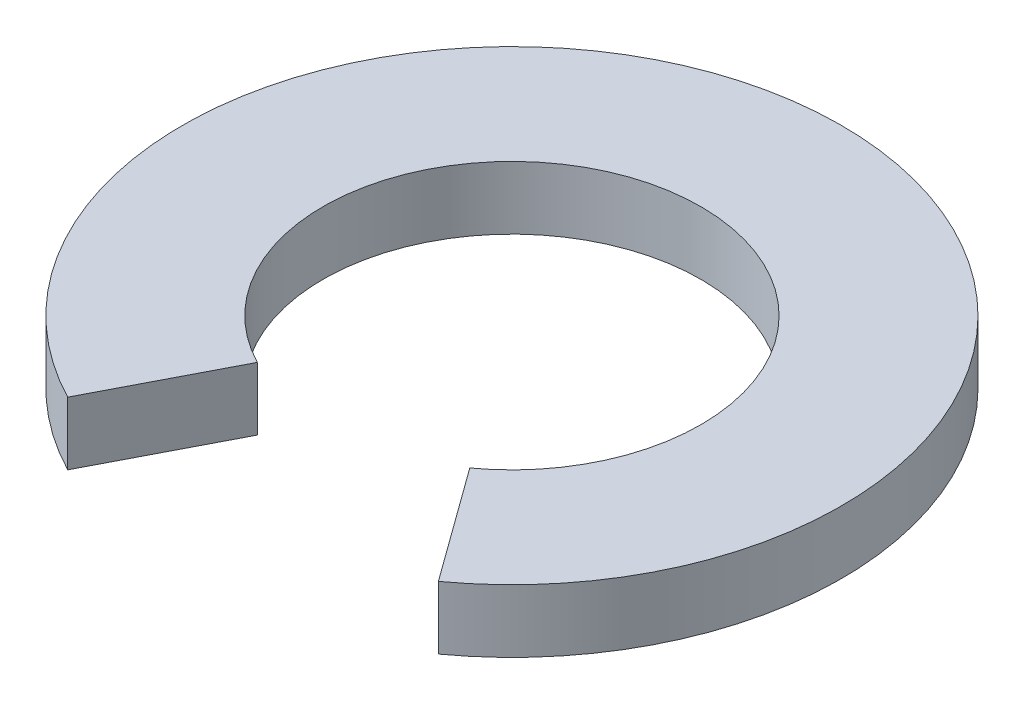
from build123d import *

# Parameters (mm, degrees)
BOSS_EXTRUDE1_DEPTH = 0.5


with BuildPart() as part:
    # Sketch1 → Boss-Extrude1 (new body)
    with BuildSketch(Plane(origin=(0, 0, 0), x_dir=(1, 0, 0), z_dir=(0, 1, 0))):
        with BuildLine():
            ThreePointArc((1.734559672, 1.959088748), (0, 2.616624921), (-1.734559672, 1.959088748))
            Line((-1.734559672, 1.959088748), (-0.994349434, 1.123062422))
            ThreePointArc((-0.994349434, 1.123062422), (-0.033994196, 1.499614749), (0.942437635, 1.166966711))
            Line((0.942437635, 1.166966711), (1.734559672, 1.959088748))
        make_face()
        with BuildLine():
            ThreePointArc((-1.734559672, 1.959088748), (-2.596707821, -0.32223357), (-1.203103437, -2.323632522))
            Line((-1.203103437, -2.323632522), (-0.689688133, -1.332039894))
            ThreePointArc((-0.689688133, -1.332039894), (-1.488582372, -0.184722828), (-0.994349434, 1.123062422))
            Line((-0.994349434, 1.123062422), (-1.734559672, 1.959088748))
        make_face()
        with BuildLine():
            Line((0.880018763, -1.214729178), (1.535119351, -2.11899376))
            ThreePointArc((1.535119351, -2.11899376), (2.330617679, -1.189515537), (2.616624921, 0))
            ThreePointArc((2.616624921, 0), (2.385939861, 1.074251812), (1.734559672, 1.959088748))
            Line((1.734559672, 1.959088748), (0.942437635, 1.166966711))
            ThreePointArc((0.942437635, 1.166966711), (1.353450489, 0.646662024), (1.5, 0))
            ThreePointArc((1.5, 0), (1.336044188, -0.681898766), (0.880018763, -1.214729178))
        make_face()
    extrude(amount=BOSS_EXTRUDE1_DEPTH)


solid = part.part
